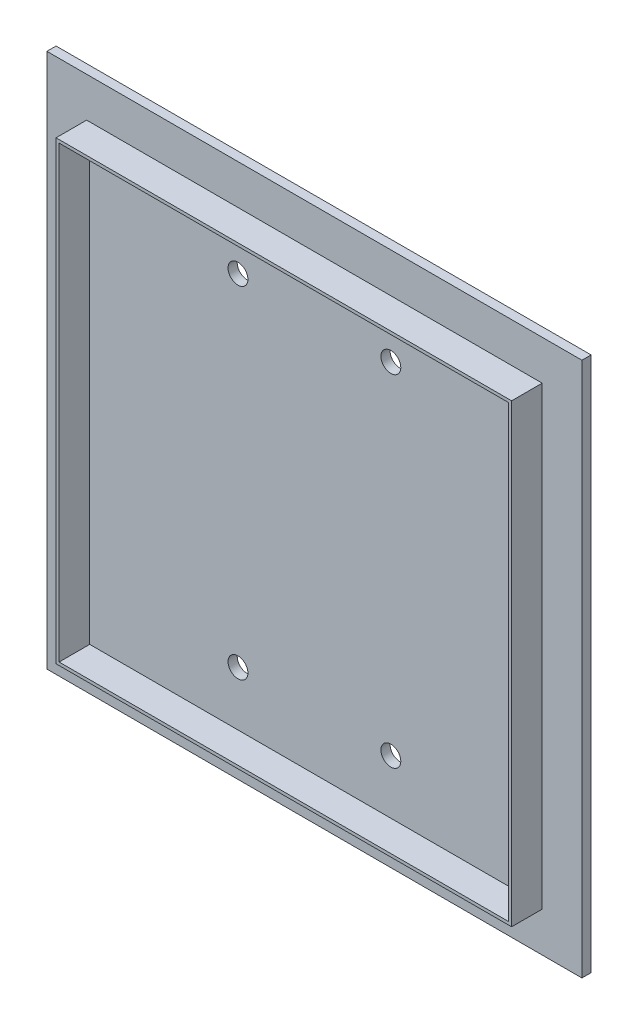
from build123d import *

# Parameters (mm, degrees)
ESQUISSE1_W                  = 350
ESQUISSE1_H                  = 350
BOSS_EXTRU_1_DEPTH           = 26
ESQUISSE2_W                  = 350
ESQUISSE2_H                  = 350
ESQUISSE2_W_2                = 298
ESQUISSE2_H_2                = 298
ENL_V_MAT_EXTRU_1_DEPTH      = 20
ESQUISSE3_W                  = 294
ESQUISSE3_H                  = 294
ENL_V_MAT_EXTRU_2_DEPTH      = 20
ENL_V_MAT_EXTRU_3_DEPTH      = 249.849352018
ENL_V_MAT_EXTRU_3_DEPTH_BACK = 249.849352018
ESQUISSE5_R                  = 6.5


with BuildPart() as part:
    # Esquisse1 → Boss.-Extru.1 (new body)
    with BuildSketch(Plane.XY):
        Rectangle(ESQUISSE1_W, ESQUISSE1_H)
    extrude(amount=BOSS_EXTRU_1_DEPTH)

    # Esquisse2 → Enlèv. mat.-Extru.1 (cut)
    with BuildSketch(Plane.XY.offset(26)):
        Rectangle(ESQUISSE2_W, ESQUISSE2_H)
        Rectangle(ESQUISSE2_W_2, ESQUISSE2_H_2, mode=Mode.SUBTRACT)
    extrude(amount=-ENL_V_MAT_EXTRU_1_DEPTH, mode=Mode.SUBTRACT)

    # Esquisse3 → Enlèv. mat.-Extru.2 (cut)
    with BuildSketch(Plane.XY.offset(26)):
        Rectangle(ESQUISSE3_W, ESQUISSE3_H)
    extrude(amount=-ENL_V_MAT_EXTRU_2_DEPTH, mode=Mode.SUBTRACT)

    # Esquisse5 → Enlèv. mat.-Extru.3 (cut, two sides: drawn at the far end of the back side and taken through both)
    with BuildSketch(Plane(origin=(0, 0, 0), x_dir=(-1, 0, 0), z_dir=(0, 0, -1)).offset(-ENL_V_MAT_EXTRU_3_DEPTH_BACK)):
        with Locations((-50, 111.5)):
            Circle(ESQUISSE5_R)
        with Locations((50, 111.5)):
            Circle(ESQUISSE5_R)
        with Locations((50, -111.5)):
            Circle(ESQUISSE5_R)
        with Locations((-50, -111.5)):
            Circle(ESQUISSE5_R)
    extrude(amount=ENL_V_MAT_EXTRU_3_DEPTH + ENL_V_MAT_EXTRU_3_DEPTH_BACK, mode=Mode.SUBTRACT)


solid = part.part
